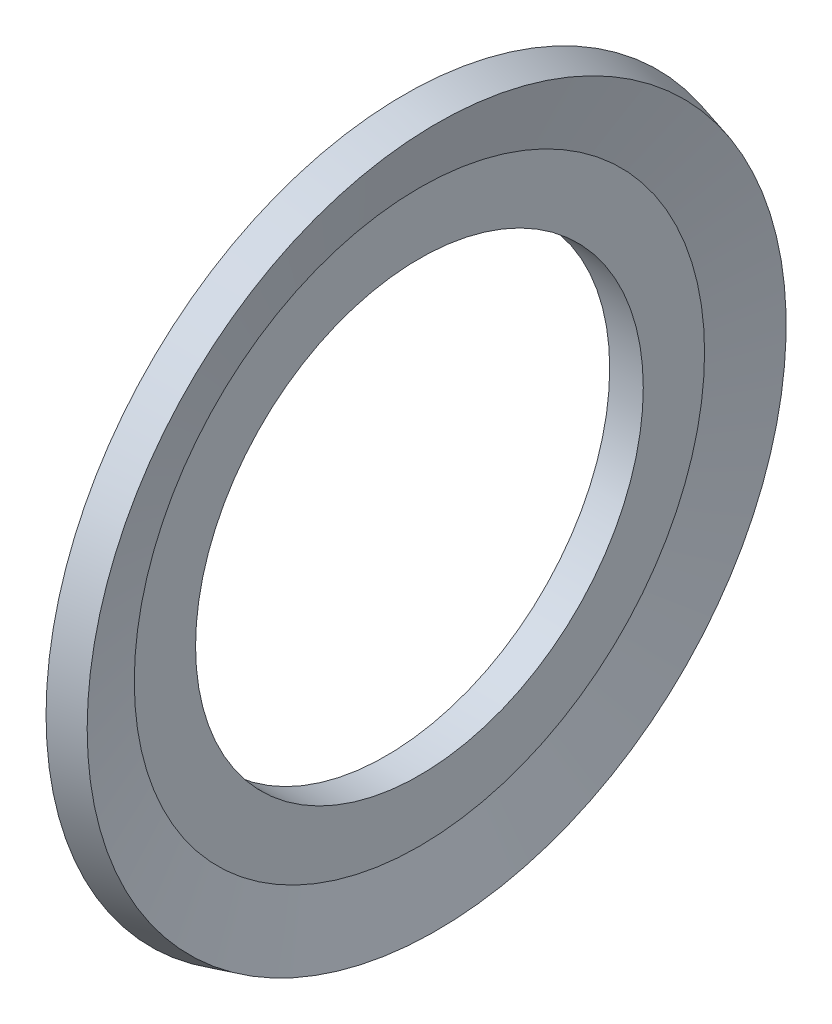
from build123d import *


with BuildPart() as part:
    # Sketch1 → Revolve1 (revolve)
    with BuildSketch(Plane.XY, mode=Mode.PRIVATE) as revolve1_sk:
        Polygon((0, 10), (0, 12.935), (0.821264275, 16), (2.270153014, 15.611771432), (1.5, 12.737521254), (1.5, 10), align=None)
    revolve(revolve1_sk.sketch.rotate(Axis((0, 0, 0), (1, 0, 0)), 90), axis=Axis((0, 0, 0), (1, 0, 0)))


solid = part.part
